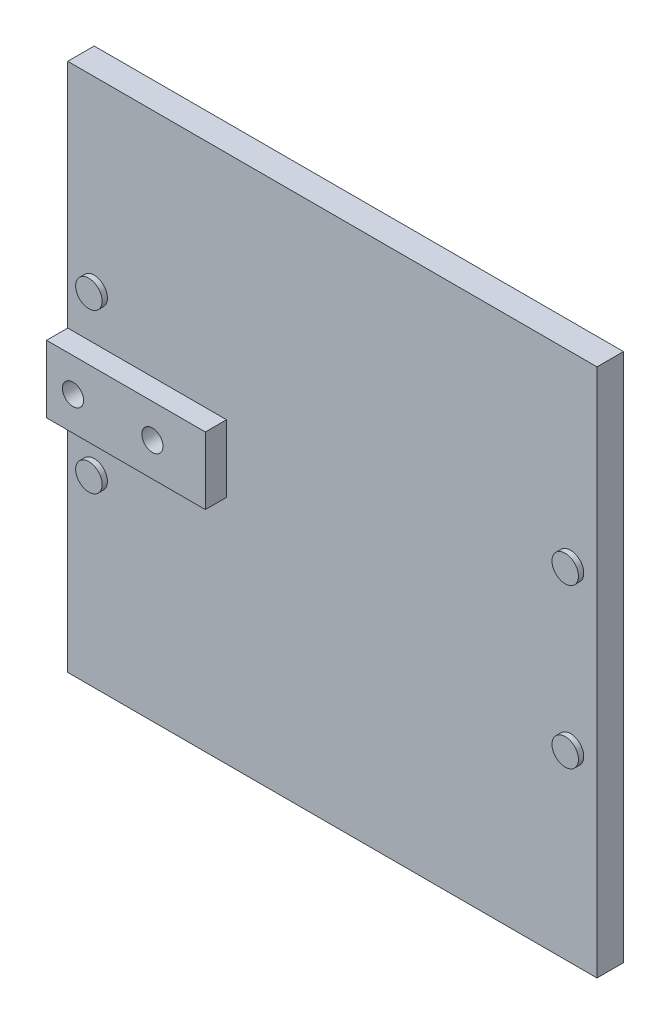
from build123d import *

# Parameters (mm, degrees)
IZIM1_W                       = 100
IZIM1_H                       = 100
Y_KSEKLIK_EKSTR_ZYON1_DEPTH   = 5
IZIM2_W                       = 30
IZIM2_H                       = 12.7
Y_KSEKLIK_EKSTR_ZYON2_DEPTH   = 4
KES_EKSTR_ZYON2_DEPTH         = 71.887234394
KES_EKSTR_ZYON2_DEPTH_BACK    = 35
IZIM3_R                       = 2.5
IZIM4_R                       = 2.5
Y_KSEKLIK_EKSTR_ZYON3_DEPTH   = 1
Y_KSEKLIK_EKSTR_ZYON3_2_DEPTH = 1
Y_KSEKLIK_EKSTR_ZYON3_3_DEPTH = 1
Y_KSEKLIK_EKSTR_ZYON3_4_DEPTH = 1
IZIM5_R                       = 2
KES_EKSTR_ZYON3_DEPTH         = 4


with BuildPart() as part:
    # Çizim1 → Yükseklik-Ekstrüzyon1 (new body)
    with BuildSketch(Plane.XY):
        Rectangle(IZIM1_W, IZIM1_H)
    extrude(amount=Y_KSEKLIK_EKSTR_ZYON1_DEPTH)

    # Çizim2 → Yükseklik-Ekstrüzyon2 (add)
    with BuildSketch(Plane.XY.offset(5)):
        with Locations((-35, 0)):
            Rectangle(IZIM2_W, IZIM2_H)
    extrude(amount=Y_KSEKLIK_EKSTR_ZYON2_DEPTH)

    # Çizim3 → Kes-Ekstrüzyon2 (cut, two sides: drawn at the far end of the back side and taken through both)
    with BuildSketch(Plane.XY.offset(5).offset(-KES_EKSTR_ZYON2_DEPTH_BACK)):
        with Locations((-45, 15)):
            Circle(IZIM3_R)
        with Locations((-45, -15)):
            Circle(IZIM3_R)
        with Locations((45, 15)):
            Circle(IZIM3_R)
        with Locations((45, -15)):
            Circle(IZIM3_R)
    extrude(amount=KES_EKSTR_ZYON2_DEPTH + KES_EKSTR_ZYON2_DEPTH_BACK, mode=Mode.SUBTRACT)

    # Çizim5 → Kes-Ekstrüzyon3 (cut)
    with BuildSketch(Plane.XY.offset(9)):
        with Locations((-45, 0)):
            Circle(IZIM5_R)
        with Locations((-30, 0)):
            Circle(IZIM5_R)
    extrude(amount=-KES_EKSTR_ZYON3_DEPTH, mode=Mode.SUBTRACT)


with BuildPart() as body_2:
    # Çizim4 → Yükseklik-Ekstrüzyon3 (new body)
    with BuildSketch(Plane.XY.offset(5)):
        with Locations((-45, 15)):
            Circle(IZIM4_R)
    extrude(amount=Y_KSEKLIK_EKSTR_ZYON3_DEPTH)


with BuildPart() as body_3:
    # Çizim4 → Y_kseklik-Ekstr_zyon3 2 (new body)
    with BuildSketch(Plane.XY.offset(5)):
        with Locations((45, 15)):
            Circle(IZIM4_R)
    extrude(amount=Y_KSEKLIK_EKSTR_ZYON3_2_DEPTH)


with BuildPart() as body_4:
    # Çizim4 → Y_kseklik-Ekstr_zyon3 3 (new body)
    with BuildSketch(Plane.XY.offset(5)):
        with Locations((-45, -15)):
            Circle(IZIM4_R)
    extrude(amount=Y_KSEKLIK_EKSTR_ZYON3_3_DEPTH)


with BuildPart() as body_5:
    # Çizim4 → Y_kseklik-Ekstr_zyon3 4 (new body)
    with BuildSketch(Plane.XY.offset(5)):
        with Locations((45, -15)):
            Circle(IZIM4_R)
    extrude(amount=Y_KSEKLIK_EKSTR_ZYON3_4_DEPTH)


solid = Compound([part.part, body_2.part, body_3.part, body_4.part, body_5.part])
